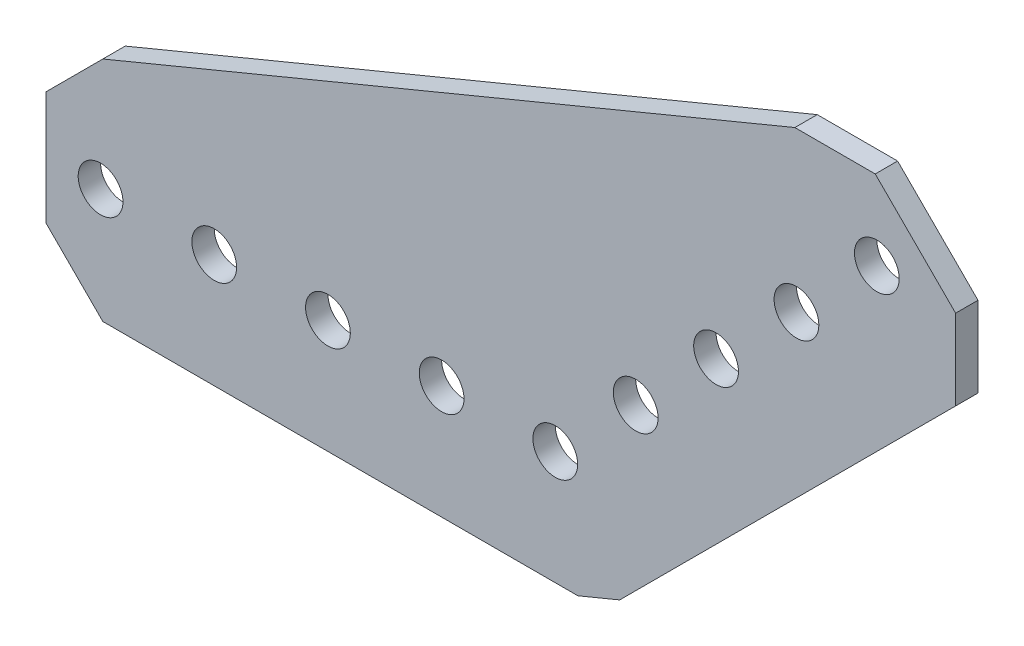
from build123d import *

# Parameters (mm, degrees)
SKETCH1_R           = 2.5
BOSS_EXTRUDE1_DEPTH = 2.5


with BuildPart() as part:
    # Sketch1 → Boss-Extrude1 (new body)
    with BuildSketch(Plane(origin=(0, 0, -1.25), x_dir=(-1, 0, 0), z_dir=(0, 0, -1))):
        Polygon((50.546, 12.7), (-26.761163241, 44.721675483), (-35.741419362, 44.721675483), (-44.721675483, 35.741419362), (-44.721675483, 26.761163241), (-7.193972116, -10.766540126), (-2.526187066, -12.7), (50.546, -12.7), (56.896, -6.35), (56.896, 6.35), align=None)
        with Locations(Location((12.7, 0, 0), (0, 0, 180))):
            Circle(SKETCH1_R, mode=Mode.SUBTRACT)
        with Locations(Location((25.4, 0, 0), (0, 0, 180))):
            Circle(SKETCH1_R, mode=Mode.SUBTRACT)
        with Locations(Location((0, 0, 0), (0, 0, 180))):
            Circle(SKETCH1_R, mode=Mode.SUBTRACT)
        with Locations(Location((50.8, 0, 0), (0, 0, 180))):
            Circle(SKETCH1_R, mode=Mode.SUBTRACT)
        with Locations(Location((38.1, 0, 0), (0, 0, 180))):
            Circle(SKETCH1_R, mode=Mode.SUBTRACT)
        with Locations(Location((-35.921024484, 35.921024484, 0), (0, 0, 180))):
            Circle(SKETCH1_R, mode=Mode.SUBTRACT)
        with Locations(Location((-26.940768363, 26.940768363, 0), (0, 0, 180))):
            Circle(SKETCH1_R, mode=Mode.SUBTRACT)
        with Locations(Location((-17.960512242, 17.960512242, 0), (0, 0, 180))):
            Circle(SKETCH1_R, mode=Mode.SUBTRACT)
        with Locations(Location((-8.980256121, 8.980256121, 0), (0, 0, 180))):
            Circle(SKETCH1_R, mode=Mode.SUBTRACT)
    extrude(amount=-BOSS_EXTRUDE1_DEPTH)


solid = part.part
